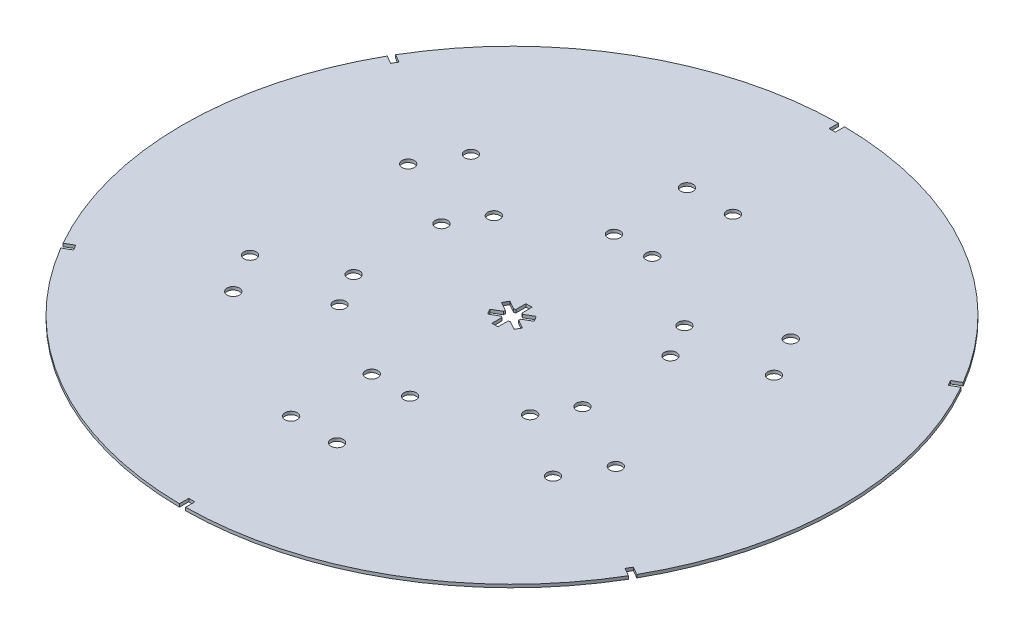
from build123d import *

# Parameters (mm, degrees)
SKETCH1_R           = 4
BOSS_EXTRUDE1_DEPTH = 1


with BuildPart() as part:
    # Sketch1 → Boss-Extrude1 (new, symmetric)
    with BuildSketch(Plane(origin=(0, 0, 0), x_dir=(1, 0, 0), z_dir=(0, 1, 0))):
        with BuildLine():
            Line((-181.921418525, 102.72297888), (-187.187405589, 105.763297929))
            ThreePointArc((-187.187405589, 105.763297929), (-215, 0), (-187.187405589, -105.763297929))
            Line((-187.187405589, -105.763297929), (-181.921418525, -102.72297888))
            Line((-181.921418525, -102.72297888), (-179.921418525, -106.187080495))
            Line((-179.921418525, -106.187080495), (-185.187405589, -109.227399544))
            ThreePointArc((-185.187405589, -109.227399544), (-107.5, -186.195461814), (-2, -214.990697473))
            Line((-2, -214.990697473), (-2, -208.910059376))
            Line((-2, -208.910059376), (2, -208.910059376))
            Line((2, -208.910059376), (2, -214.990697473))
            ThreePointArc((2, -214.990697473), (107.5, -186.195461814), (185.187405589, -109.227399544))
            Line((185.187405589, -109.227399544), (179.921418525, -106.187080495))
            Line((179.921418525, -106.187080495), (181.921418525, -102.72297888))
            Line((181.921418525, -102.72297888), (187.187405589, -105.763297929))
            ThreePointArc((187.187405589, -105.763297929), (215, 0), (187.187405589, 105.763297929))
            Line((187.187405589, 105.763297929), (181.921418525, 102.72297888))
            Line((181.921418525, 102.72297888), (179.921418525, 106.187080495))
            Line((179.921418525, 106.187080495), (185.187405589, 109.227399544))
            ThreePointArc((185.187405589, 109.227399544), (107.5, 186.195461814), (2, 214.990697473))
            Line((2, 214.990697473), (2, 208.910059376))
            Line((2, 208.910059376), (-2, 208.910059376))
            Line((-2, 208.910059376), (-2, 214.990697473))
            ThreePointArc((-2, 214.990697473), (-107.5, 186.195461814), (-185.187405589, 109.227399544))
            Line((-185.187405589, 109.227399544), (-179.921418525, 106.187080495))
            Line((-179.921418525, 106.187080495), (-181.921418525, 102.72297888))
        make_face()
        with Locations(Location((-15, -129.131715701, 0), (0, 0, 270))):
            Circle(SKETCH1_R, mode=Mode.SUBTRACT)
        with Locations(Location((-119.331346232, -51.575476794, 0), (0, 0, 270))):
            Circle(SKETCH1_R, mode=Mode.SUBTRACT)
        with Locations(Location((-104.331346232, -77.556238907, 0), (0, 0, 270))):
            Circle(SKETCH1_R, mode=Mode.SUBTRACT)
        with Locations(Location((-12.5, -79.017403146, 0), (0, 0, 270))):
            Circle(SKETCH1_R, mode=Mode.SUBTRACT)
        with Locations(Location((-62.181078466, -50.334019121, 0), (0, 0, 270))):
            Circle(SKETCH1_R, mode=Mode.SUBTRACT)
        with Locations(Location((-74.681078466, -28.683384026, 0), (0, 0, 270))):
            Circle(SKETCH1_R, mode=Mode.SUBTRACT)
        with Locations(Location((15, -129.131715701, 0), (0, 0, 270))):
            Circle(SKETCH1_R, mode=Mode.SUBTRACT)
        with Locations(Location((12.5, -79.017403146, 0), (0, 0, 270))):
            Circle(SKETCH1_R, mode=Mode.SUBTRACT)
        with Locations(Location((104.331346232, -77.556238907, 0), (0, 0, 270))):
            Circle(SKETCH1_R, mode=Mode.SUBTRACT)
        with BuildLine():
            Line((-10.609274752, 3.826177687), (-8.609274752, 7.290279302))
            Line((-8.609274752, 7.290279302), (-2.96077803, 4.029118199))
            ThreePointArc((-2.96077803, 4.029118199), (-2.491557477, 4.33499035), (-1.9910703, 4.586462587))
            Line((-1.9910703, 4.586462587), (-1.9910703, 11.100990294))
            Line((-1.9910703, 11.100990294), (2.0089297, 11.100990294))
            Line((2.0089297, 11.100990294), (2.0089297, 4.578668088))
            ThreePointArc((2.0089297, 4.578668088), (2.50843303, 4.325247245), (2.976457964, 4.017548754))
            Line((2.976457964, 4.017548754), (8.618204452, 7.274812608))
            Line((8.618204452, 7.274812608), (10.618204452, 3.810710993))
            Line((10.618204452, 3.810710993), (4.96970773, 0.549549889))
            ThreePointArc((4.96970773, 0.549549889), (4.999990507, -0.009743105), (4.967528264, -0.568913833))
            Line((4.967528264, -0.568913833), (10.609274752, -3.826177687))
            Line((10.609274752, -3.826177687), (8.609274752, -7.290279302))
            Line((8.609274752, -7.290279302), (2.96077803, -4.029118199))
            ThreePointArc((2.96077803, -4.029118199), (2.491557477, -4.33499035), (1.9910703, -4.586462587))
            Line((1.9910703, -4.586462587), (1.9910703, -11.100990294))
            Line((1.9910703, -11.100990294), (-2.0089297, -11.100990294))
            Line((-2.0089297, -11.100990294), (-2.0089297, -4.578668088))
            ThreePointArc((-2.0089297, -4.578668088), (-2.50843303, -4.325247245), (-2.976457964, -4.017548754))
            Line((-2.976457964, -4.017548754), (-8.618204452, -7.274812608))
            Line((-8.618204452, -7.274812608), (-10.618204452, -3.810710993))
            Line((-10.618204452, -3.810710993), (-4.96970773, -0.549549889))
            ThreePointArc((-4.96970773, -0.549549889), (-4.999990507, 0.009743105), (-4.967528264, 0.568913833))
            Line((-4.967528264, 0.568913833), (-10.609274752, 3.826177687))
        make_face(mode=Mode.SUBTRACT)
        with Locations(Location((62.181078466, -50.334019121, 0), (0, 0, 270))):
            Circle(SKETCH1_R, mode=Mode.SUBTRACT)
        with Locations(Location((74.681078466, -28.683384026, 0), (0, 0, 270))):
            Circle(SKETCH1_R, mode=Mode.SUBTRACT)
        with Locations(Location((119.331346232, -51.575476794, 0), (0, 0, 270))):
            Circle(SKETCH1_R, mode=Mode.SUBTRACT)
        with Locations(Location((-119.331346232, 51.575476794, 0), (0, 0, 270))):
            Circle(SKETCH1_R, mode=Mode.SUBTRACT)
        with Locations(Location((-74.681078466, 28.683384026, 0), (0, 0, 270))):
            Circle(SKETCH1_R, mode=Mode.SUBTRACT)
        with Locations(Location((-62.181078466, 50.334019121, 0), (0, 0, 270))):
            Circle(SKETCH1_R, mode=Mode.SUBTRACT)
        with Locations(Location((-104.331346232, 77.556238907, 0), (0, 0, 270))):
            Circle(SKETCH1_R, mode=Mode.SUBTRACT)
        with Locations(Location((-12.5, 79.017403146, 0), (0, 0, 270))):
            Circle(SKETCH1_R, mode=Mode.SUBTRACT)
        with Locations(Location((-15, 129.131715701, 0), (0, 0, 270))):
            Circle(SKETCH1_R, mode=Mode.SUBTRACT)
        with Locations(Location((74.681078466, 28.683384026, 0), (0, 0, 270))):
            Circle(SKETCH1_R, mode=Mode.SUBTRACT)
        with Locations(Location((62.181078466, 50.334019121, 0), (0, 0, 270))):
            Circle(SKETCH1_R, mode=Mode.SUBTRACT)
        with Locations(Location((12.5, 79.017403146, 0), (0, 0, 270))):
            Circle(SKETCH1_R, mode=Mode.SUBTRACT)
        with Locations(Location((104.331346232, 77.556238907, 0), (0, 0, 270))):
            Circle(SKETCH1_R, mode=Mode.SUBTRACT)
        with Locations(Location((119.331346232, 51.575476794, 0), (0, 0, 270))):
            Circle(SKETCH1_R, mode=Mode.SUBTRACT)
        with Locations(Location((15, 129.131715701, 0), (0, 0, 270))):
            Circle(SKETCH1_R, mode=Mode.SUBTRACT)
    extrude(amount=BOSS_EXTRUDE1_DEPTH, both=True)


solid = part.part
